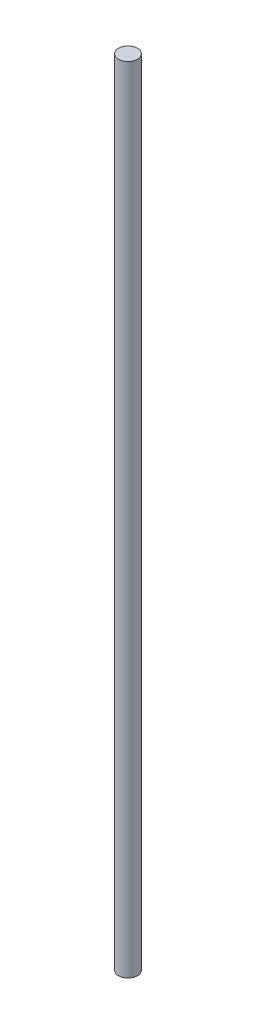
from build123d import *

# Parameters (mm, degrees)
SKETCH1_R           = 6
BOSS_EXTRUDE2_DEPTH = 500


with BuildPart() as part:
    # Sketch1 → Boss-Extrude2 (new body)
    with BuildSketch(Plane(origin=(0, 0, 0), x_dir=(1, 0, 0), z_dir=(0, 1, 0))):
        with Locations(Location((0, 0, 0), (0, 0, 270))):
            Circle(SKETCH1_R)
    extrude(amount=BOSS_EXTRUDE2_DEPTH)


solid = part.part
